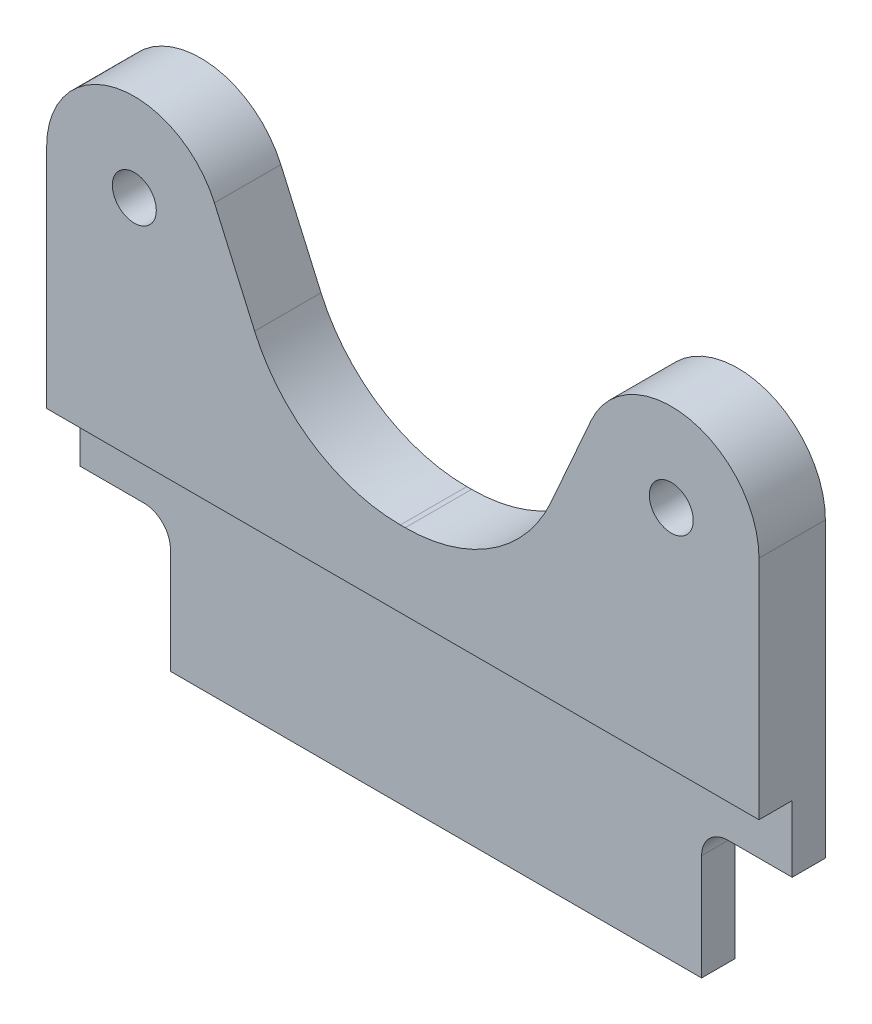
from build123d import *

# Parameters (mm, degrees)
BOSS_EXTRU_1_DEPTH             = 3.175
ESQUISSE3_R                    = 2.1
ENL_V_MAT_EXTRU_1_DEPTH        = 51.235046687
ENL_V_MAT_EXTRU_2_DEPTH        = 3.175
CONG_1_R                       = 15.24
CONG_2_R                       = 15.24
BOSS_EXTRU_3_REACH             = 51.933
BOSS_EXTRU_3_DIRECTION_2_REACH = 51.933
ENL_V_MAT_EXTRU_3_DEPTH        = 3.175
CONG_3_R                       = 2.54


with BuildPart() as part:
    # Esquisse2 → Boss.-Extru.1 (new, symmetric)
    with BuildSketch(Plane.XY):
        with BuildLine():
            Line((25.4, 0), (33.652960284, 25.4))
            ThreePointArc((33.652960284, 25.4), (28.67359617, 35.819836664), (18.013926444, 31.377032999))
            Line((18.013926444, 31.377032999), (10.16, 13.597032999))
            Line((10.16, 13.597032999), (-10.16, 13.597032999))
            Line((-10.16, 13.597032999), (-18.013926444, 31.377032999))
            ThreePointArc((-18.013926444, 31.377032999), (-28.67359617, 35.819836664), (-33.652960284, 25.4))
            Line((-33.652960284, 25.4), (-25.4, 0))
            Line((-25.4, 0), (-25.4, -12.7))
            Line((-25.4, -12.7), (25.4, -12.7))
            Line((25.4, -12.7), (25.4, 0))
        make_face()
    extrude(amount=BOSS_EXTRU_1_DEPTH, both=True)

    # Esquisse3 → Enlèv. mat.-Extru.1 (cut, through all)
    with BuildSketch(Plane.XY.offset(3.175)):
        with Locations((-25.673864308, 27.96758946)):
            Circle(ESQUISSE3_R)
    enl_v_mat_extru_1 = extrude(amount=-ENL_V_MAT_EXTRU_1_DEPTH, mode=Mode.SUBTRACT)

    # Symétrie1: Enlèv. mat.-Extru.1 across plane
    add(enl_v_mat_extru_1.mirror(Plane(origin=(0, 0, 0), x_dir=(0, 0, 1), z_dir=(1, 0, 0))), mode=Mode.SUBTRACT)

    # Esquisse4 → Enlèv. mat.-Extru.2 (cut)
    with BuildSketch(Plane.XY.offset(3.175)):
        Polygon((27.454849211, 6.324175587), (-27.454849211, 6.324175587), (-25.4, 0), (-25.4, -12.7), (25.4, -12.7), (25.4, 0), align=None)
    extrude(amount=-ENL_V_MAT_EXTRU_2_DEPTH, mode=Mode.SUBTRACT)

    # Congé1
    cong_1_edges = [part.edges().sort_by_distance(p)[0] for p in [
        (-10.16, 13.597032999, 0),
        (10.16, 13.597032999, 0),
    ]]
    fillet(cong_1_edges, radius=CONG_1_R)

    # Congé2
    cong_2_edges = [part.edges().sort_by_distance(p)[0] for p in [
        (-25.4, 0, -1.5875),
        (25.4, 0, -1.5875),
    ]]
    fillet(cong_2_edges, radius=CONG_2_R)

    # Boss.-Extru.3: up to this face of the body (flat: up to its plane)
    boss_extru_3_end = Plane(part.part.faces().sort_by_distance((-16.773966377, 26.7272166, 3.175))[0])
    # Esquisse8 → Boss.-Extru.3 (add, up to the picked face)
    with BuildSketch(Plane.XY, mode=Mode.PRIVATE) as boss_extru_3_sk1:
        with BuildLine():
            Line((-27.454849211, 6.324175587), (-26.145898692, 2.295640124))
            ThreePointArc((-26.145898692, 2.295640124), (-25.821082413, 1.143928475), (-25.587629689, -0.029717623))
            Line((-25.587629689, -0.029717623), (-34.063204565, -0.029717623))
            Line((-34.063204565, -0.029717623), (-34.063204565, 27.990180447))
            ThreePointArc((-34.063204565, 27.990180447), (-33.960008236, 26.678946761), (-33.652960284, 25.4))
            Line((-33.652960284, 25.4), (-27.454849211, 6.324175587))
        make_face()
    boss_extru_3_tool1 = split(extrude(boss_extru_3_sk1.sketch, amount=BOSS_EXTRU_3_REACH, mode=Mode.PRIVATE), bisect_by=boss_extru_3_end, keep=Keep.BOTH, mode=Mode.PRIVATE)
    boss_extru_3 = boss_extru_3_tool1.solids().sort_by(Axis((-31.181863, 8.892932, 0), (0, 0, 1)))[0]
    add(boss_extru_3)

    # Boss.-Extru.3 direction 2: up to this face of the body (flat: up to its plane)
    boss_extru_3_direction_2_end = Plane(part.part.faces().sort_by_distance((0, 8.816587411, -3.175))[0])
    # Esquisse8 → Boss.-Extru.3 direction 2 (add, up to the picked face)
    with BuildSketch(Plane.XY, mode=Mode.PRIVATE) as boss_extru_3_direction_2_sk1:
        with BuildLine():
            Line((-27.454849211, 6.324175587), (-26.145898692, 2.295640124))
            ThreePointArc((-26.145898692, 2.295640124), (-25.821082413, 1.143928475), (-25.587629689, -0.029717623))
            Line((-25.587629689, -0.029717623), (-34.063204565, -0.029717623))
            Line((-34.063204565, -0.029717623), (-34.063204565, 27.990180447))
            ThreePointArc((-34.063204565, 27.990180447), (-33.960008236, 26.678946761), (-33.652960284, 25.4))
            Line((-33.652960284, 25.4), (-27.454849211, 6.324175587))
        make_face()
    boss_extru_3_direction_2_tool1 = split(extrude(boss_extru_3_direction_2_sk1.sketch, amount=-BOSS_EXTRU_3_DIRECTION_2_REACH, mode=Mode.PRIVATE), bisect_by=boss_extru_3_direction_2_end, keep=Keep.BOTH, mode=Mode.PRIVATE)
    boss_extru_3_direction_2 = boss_extru_3_direction_2_tool1.solids().sort_by(Axis((-31.181863, 8.892932, 0), (0, 0, -1)))[0]
    add(boss_extru_3_direction_2)

    # Symétrie2: Boss.-Extru.3, Boss.-Extru.3 direction 2 across plane
    add(boss_extru_3.mirror(Plane(origin=(0, 0, 0), x_dir=(0, 0, 1), z_dir=(1, 0, 0))))
    add(boss_extru_3_direction_2.mirror(Plane(origin=(0, 0, 0), x_dir=(0, 0, 1), z_dir=(1, 0, 0))))

    # Esquisse9 → Enlèv. mat.-Extru.3 (cut)
    with BuildSketch(Plane.XY.offset(3.175)):
        with BuildLine():
            Line((-27.454849211, 6.324175587), (-26.145898692, 2.295640124))
            ThreePointArc((-26.145898692, 2.295640124), (-25.821082413, 1.143928475), (-25.587629689, -0.029717623))
            Line((-25.587629689, -0.029717623), (-34.063204565, -0.029717623))
            Line((-34.063204565, -0.029717623), (-34.063204565, 6.324175587))
            Line((-34.063204565, 6.324175587), (-27.454849211, 6.324175587))
        make_face()
    enl_v_mat_extru_3 = extrude(amount=-ENL_V_MAT_EXTRU_3_DEPTH, mode=Mode.SUBTRACT)

    # Symétrie3: Enlèv. mat.-Extru.3 across plane
    add(enl_v_mat_extru_3.mirror(Plane(origin=(0, 0, 0), x_dir=(0, 0, 1), z_dir=(1, 0, 0))), mode=Mode.SUBTRACT)

    # Congé3
    cong_3_edges = [part.edges().sort_by_distance(p)[0] for p in [
        (25.587629689, -0.029717623, -1.5875),
        (-25.587629689, -0.029717623, -1.5875),
    ]]
    fillet(cong_3_edges, radius=CONG_3_R)


solid = part.part
